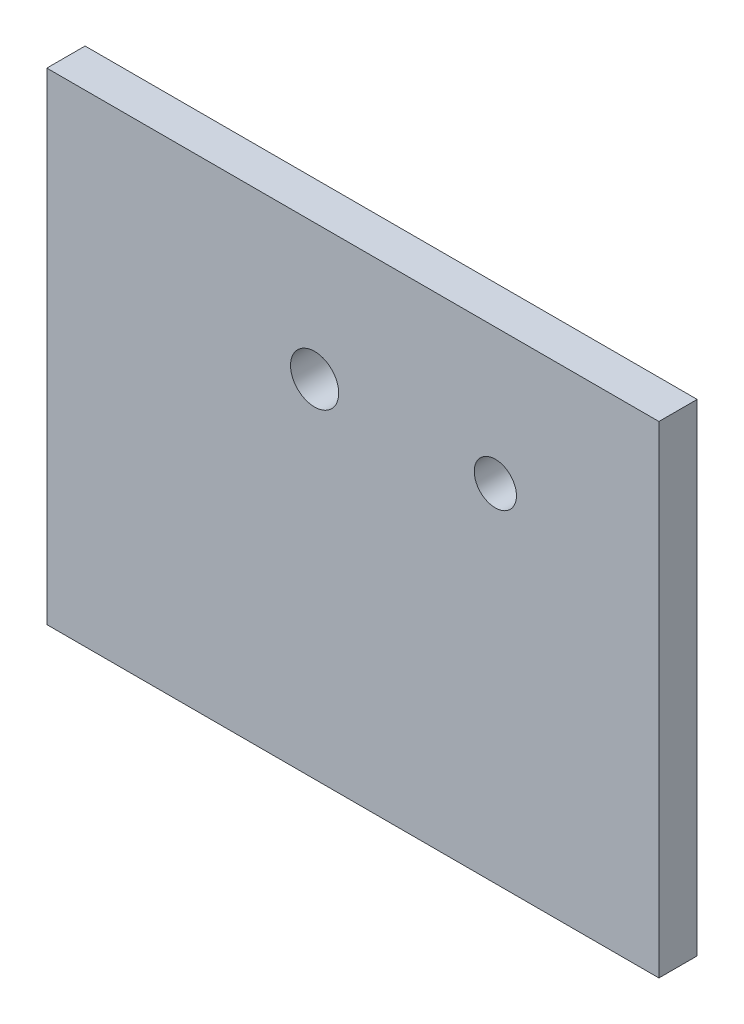
from build123d import *

# Parameters (mm, degrees)
SKETCH1_W           = 101.6
SKETCH1_H           = 80
SKETCH1_R           = 4
SKETCH1_R_2         = 3.5
BOSS_EXTRUDE1_DEPTH = 6.35


with BuildPart() as part:
    # Sketch1 → Boss-Extrude1 (new body)
    with BuildSketch(Plane.XY):
        with Locations((50.8, -40)):
            Rectangle(SKETCH1_W, SKETCH1_H)
        with Locations((44.45, -22.5)):
            Circle(SKETCH1_R, mode=Mode.SUBTRACT)
        with Locations((74.45, -22.5)):
            Circle(SKETCH1_R_2, mode=Mode.SUBTRACT)
    extrude(amount=BOSS_EXTRUDE1_DEPTH)


solid = part.part
